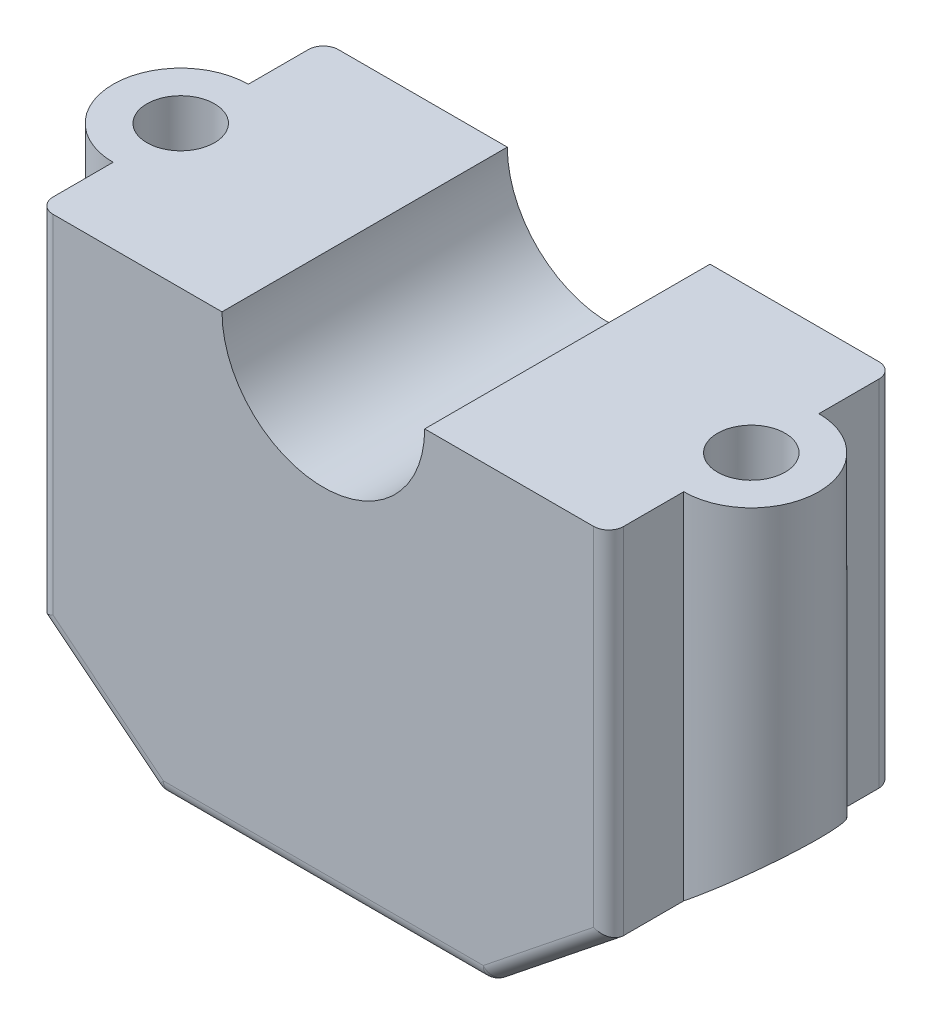
from build123d import *

# Parameters (mm, degrees)
ESBO_O2_R                  = 4.5
RESSALTO_EXTRUS_O1_DEPTH   = 60
CORTE_EXTRUS_O1_DEPTH      = 86.164546614
CORTE_EXTRUS_O6_DEPTH      = 79.549347547
CORTE_EXTRUS_O6_DEPTH_BACK = 79.549347547
CORTE_EXTRUS_O7_DEPTH      = 79.549347547
CORTE_EXTRUS_O7_DEPTH_BACK = 79.549347547
FILETE1_R                  = 2


with BuildPart() as part:
    # Esboço2 → Ressalto-extrusão1 (new body)
    with BuildSketch(Plane(origin=(0, 0, 0), x_dir=(1, 0, 0), z_dir=(0, 1, 0))):
        with BuildLine():
            Line((38, 19), (-38, 19))
            Line((-38, 19), (-38, 9))
            ThreePointArc((-38, 9), (-47, 0), (-38, -9))
            Line((-38, -9), (-38, -19))
            Line((-38, -19), (38, -19))
            Line((38, -19), (38, -9))
            ThreePointArc((38, -9), (47, 0), (38, 9))
            Line((38, 9), (38, 19))
        make_face()
        with Locations(Location((-38, 0, 0), (0, 0, 270))):
            Circle(ESBO_O2_R, mode=Mode.SUBTRACT)
        with Locations(Location((38, 0, 0), (0, 0, 270))):
            Circle(ESBO_O2_R, mode=Mode.SUBTRACT)
    extrude(amount=RESSALTO_EXTRUS_O1_DEPTH)

    # Esboço3 → Corte-extrusão1 (cut, through all)
    with BuildSketch(Plane.XY.offset(19)):
        with BuildLine():
            Line((13.5, 60), (-13.5, 60))
            ThreePointArc((-13.5, 60), (0, 46.5), (13.5, 60))
        make_face()
    extrude(amount=-CORTE_EXTRUS_O1_DEPTH, mode=Mode.SUBTRACT)

    # Esboço4 → Corte-extrusão6 (cut, two sides: drawn at the far end of the back side and taken through both)
    with BuildSketch(Plane.XY.offset(-CORTE_EXTRUS_O6_DEPTH_BACK)):
        Polygon((-214.350715587, 153.88057247), (-47, 20), (-22, 0), (145.350715587, -133.88057247), (-122.410429352, -468.582003645), (-482.111860527, -180.820858705), align=None)
    extrude(amount=CORTE_EXTRUS_O6_DEPTH + CORTE_EXTRUS_O6_DEPTH_BACK, mode=Mode.SUBTRACT)

    # Esboço5 → Corte-extrusão7 (cut, two sides: drawn at the far end of the back side and taken through both)
    with BuildSketch(Plane.XY.offset(-CORTE_EXTRUS_O7_DEPTH_BACK)):
        Polygon((214.350715587, 153.88057247), (47, 20), (22, 0), (-145.350715587, -133.88057247), (122.410429352, -468.582003645), (482.111860527, -180.820858705), align=None)
    extrude(amount=CORTE_EXTRUS_O7_DEPTH + CORTE_EXTRUS_O7_DEPTH_BACK, mode=Mode.SUBTRACT)

    # Filete1
    filete1_edges = [part.edges().sort_by_distance(p)[0] for p in [
        (-38, 36.4, -19),
        (38, 36.4, -19),
        (38, 36.4, 19),
        (-38, 36.4, 19),
        (0, 0, -19),
        (0, 0, 19),
        (-30, 6.4, -19),
        (-30, 6.4, 19),
        (-22, 0, 0),
        (30, 6.4, 19),
        (22, 0, 0),
        (30, 6.4, -19),
    ]]
    fillet(filete1_edges, radius=FILETE1_R)


solid = part.part
